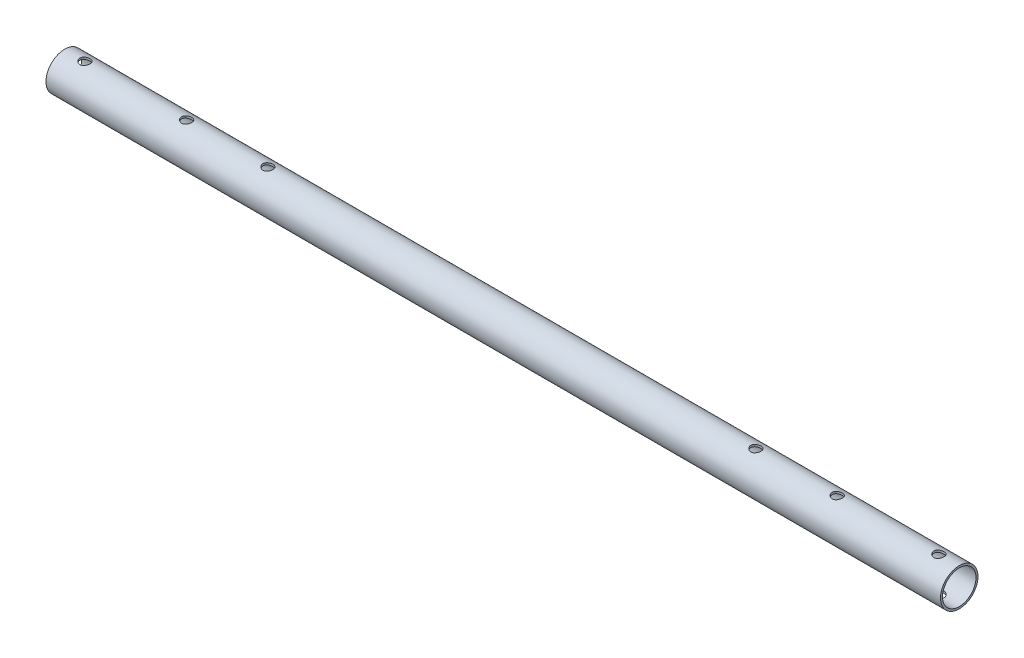
from build123d import *

# Parameters (mm, degrees)
SKETCH3_R               = 11.7094
SKETCH3_R_2             = 10.4648
BOSS_EXTRUDE1_DEPTH     = 558.8
CUT_EXTRUDE1_DEPTH      = 560.045311309
CUT_EXTRUDE1_DEPTH_BACK = 560.045311309
SKETCH4_R               = 3.175


with BuildPart() as part:
    # Sketch3 → Boss-Extrude1 (new body)
    with BuildSketch(Plane(origin=(0, 0, 0), x_dir=(0, 0, -1), z_dir=(1, 0, 0))):
        Circle(SKETCH3_R)
        Circle(SKETCH3_R_2, mode=Mode.SUBTRACT)
    extrude(amount=BOSS_EXTRUDE1_DEPTH)

    # Sketch4 → Cut-Extrude1 (cut, two sides: drawn at the far end of the back side and taken through both)
    with BuildSketch(Plane(origin=(0, 0, 0), x_dir=(1, 0, 0), z_dir=(0, 1, 0)).offset(-CUT_EXTRUDE1_DEPTH_BACK)):
        with Locations(Location((431.8, 0, 0), (0, 0, 90))):
            Circle(SKETCH4_R)
        with Locations(Location((12.7, 0, 0), (0, 0, 90))):
            Circle(SKETCH4_R)
        with Locations(Location((76.2, 0, 0), (0, 0, 90))):
            Circle(SKETCH4_R)
        with Locations(Location((482.6, 0, 0), (0, 0, 90))):
            Circle(SKETCH4_R)
        with Locations(Location((546.1, 0, 0), (0, 0, 90))):
            Circle(SKETCH4_R)
        with Locations(Location((127, 0, 0), (0, 0, 90))):
            Circle(SKETCH4_R)
    extrude(amount=CUT_EXTRUDE1_DEPTH + CUT_EXTRUDE1_DEPTH_BACK, mode=Mode.SUBTRACT)


solid = part.part
